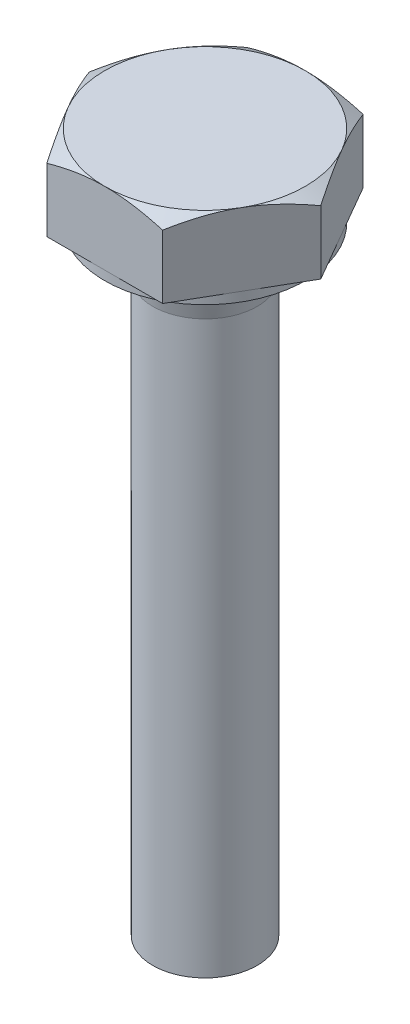
from build123d import *

# Parameters (mm, degrees)
SKIZZE2_OUTSIDE_W               = 27.018
SKIZZE2_OUTSIDE_H               = 27.018
SCHNITT_LINEAR_AUSTRAGEN1_DEPTH = 47.526928337


with BuildPart() as part:
    # Skizze1 → Basis-Rotation (revolve)
    with BuildSketch(Plane.XY, mode=Mode.PRIVATE) as basis_rotation_sk:
        Polygon((0, 5.3), (0, -40), (3.3865, -40), (3.3865, -3), (3.998, -0.002), (4, -0.002), (4, 0), (6.5, 0), (6.5, 0.6), (7.5055, 0.6), (7.5055, 4.719474304), (6.5, 5.3), align=None)
    revolve(basis_rotation_sk.sketch.rotate(Axis((0, 5.3, 0), (0, -1, 0)), 180), axis=Axis((0, 5.3, 0), (0, -1, 0)))

    # Skizze2 outside → Schnitt-Linear austragen1 (cut, through all)
    with BuildSketch(Plane(origin=(0, 5.3, 0), x_dir=(-1, 0, 0), z_dir=(0, 1, 0))):
        Rectangle(SKIZZE2_OUTSIDE_W, SKIZZE2_OUTSIDE_H)
        Polygon((-3.75277675, 6.5), (3.75277675, 6.5), (7.505553499, 0), (3.75277675, -6.5), (-3.75277675, -6.5), (-7.505553499, 0), align=None, mode=Mode.SUBTRACT)
    extrude(amount=-SCHNITT_LINEAR_AUSTRAGEN1_DEPTH, mode=Mode.SUBTRACT)


solid = part.part
